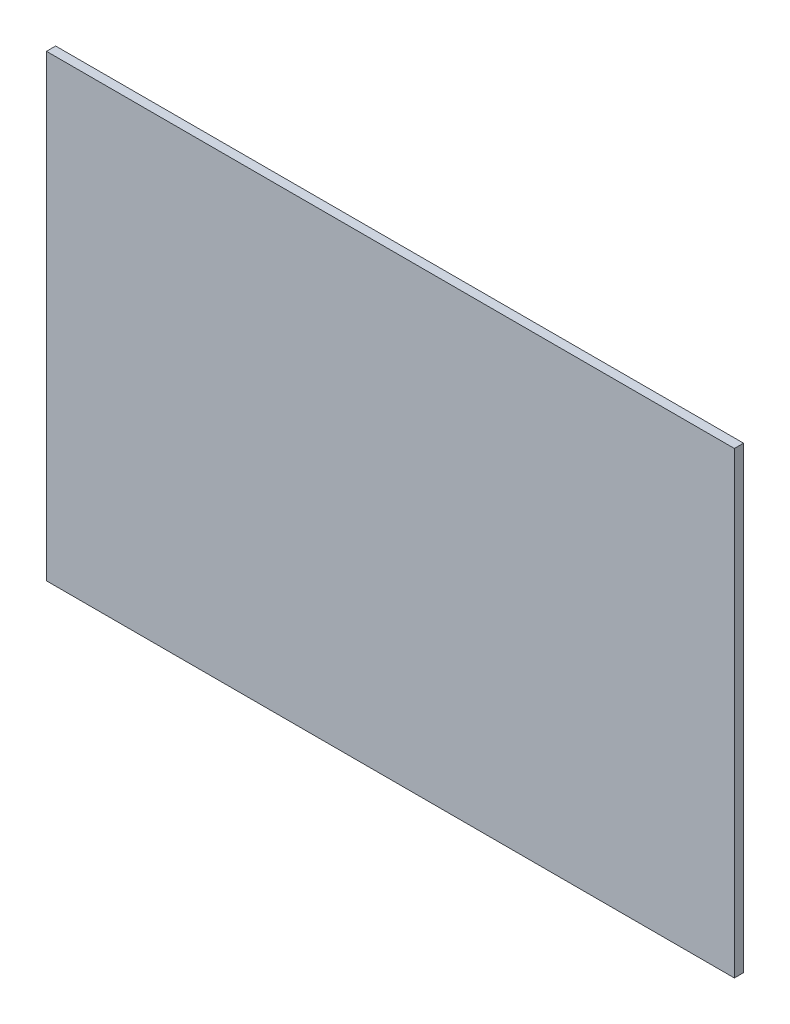
from build123d import *

# Parameters (mm, degrees)
SKETCH1_W           = 300
SKETCH1_H           = 200
BOSS_EXTRUDE1_DEPTH = 4


with BuildPart() as part:
    # Sketch1 → Boss-Extrude1 (new body)
    with BuildSketch(Plane.XY):
        Rectangle(SKETCH1_W, SKETCH1_H)
    extrude(amount=BOSS_EXTRUDE1_DEPTH)


solid = part.part
